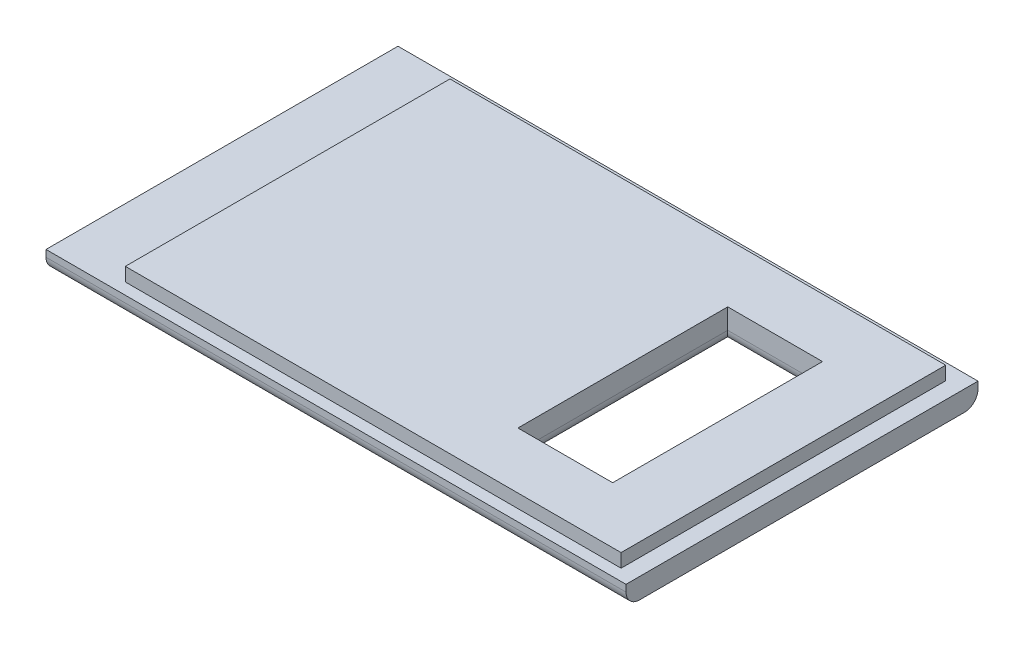
from build123d import *

# Parameters (mm, degrees)
SKETCH1_W           = 108.824103019
SKETCH1_H           = 66.04
BOSS_EXTRUDE1_DEPTH = 3.81
SKETCH5_W           = 93.0148
SKETCH5_H           = 60.9092
BOSS_EXTRUDE2_DEPTH = 2.54
FILLET1_R           = 2.54
SKETCH6_W           = 17.78
SKETCH6_H           = 39.37
CUT_EXTRUDE1_DEPTH  = 7.366
FILLET2_R           = 2.54


with BuildPart() as part:
    # Sketch1 → Boss-Extrude1 (new body)
    with BuildSketch(Plane(origin=(0, 0, 0), x_dir=(1, 0, 0), z_dir=(0, 1, 0))):
        with Locations((11.887002401, 13.227171797)):
            Rectangle(SKETCH1_W, SKETCH1_H)
    extrude(amount=BOSS_EXTRUDE1_DEPTH)

    # Sketch5 → Boss-Extrude2 (add)
    with BuildSketch(Plane(origin=(0, 3.81, 0), x_dir=(1, 0, 0), z_dir=(0, 1, 0))):
        with Locations((16.711473858, 12.815998883)):
            Rectangle(SKETCH5_W, SKETCH5_H)
    extrude(amount=BOSS_EXTRUDE2_DEPTH)

    # Fillet1
    fillet1_edges = [part.edges().sort_by_distance(p)[0] for p in [
        (11.887002402, 0, -46.247171797),
        (11.887002402, 0, 19.792828203),
    ]]
    fillet(fillet1_edges, radius=FILLET1_R)

    # Sketch6 → Cut-Extrude1 (cut)
    with BuildSketch(Plane(origin=(0, 6.35, 0), x_dir=(1, 0, 0), z_dir=(0, 1, 0))):
        with Locations((42.189853997, 12.607362778)):
            Rectangle(SKETCH6_W, SKETCH6_H)
    extrude(amount=-CUT_EXTRUDE1_DEPTH, mode=Mode.SUBTRACT)

    # Fillet2
    fillet2_edges = [part.edges().sort_by_distance(p)[0] for p in [
        (42.189853997, 0, 7.077637222),
        (33.299853997, 0, -12.607362778),
        (42.189853997, 0, -32.292362778),
        (51.079853997, 0, -12.607362778),
    ]]
    fillet(fillet2_edges, radius=FILLET2_R)


solid = part.part
